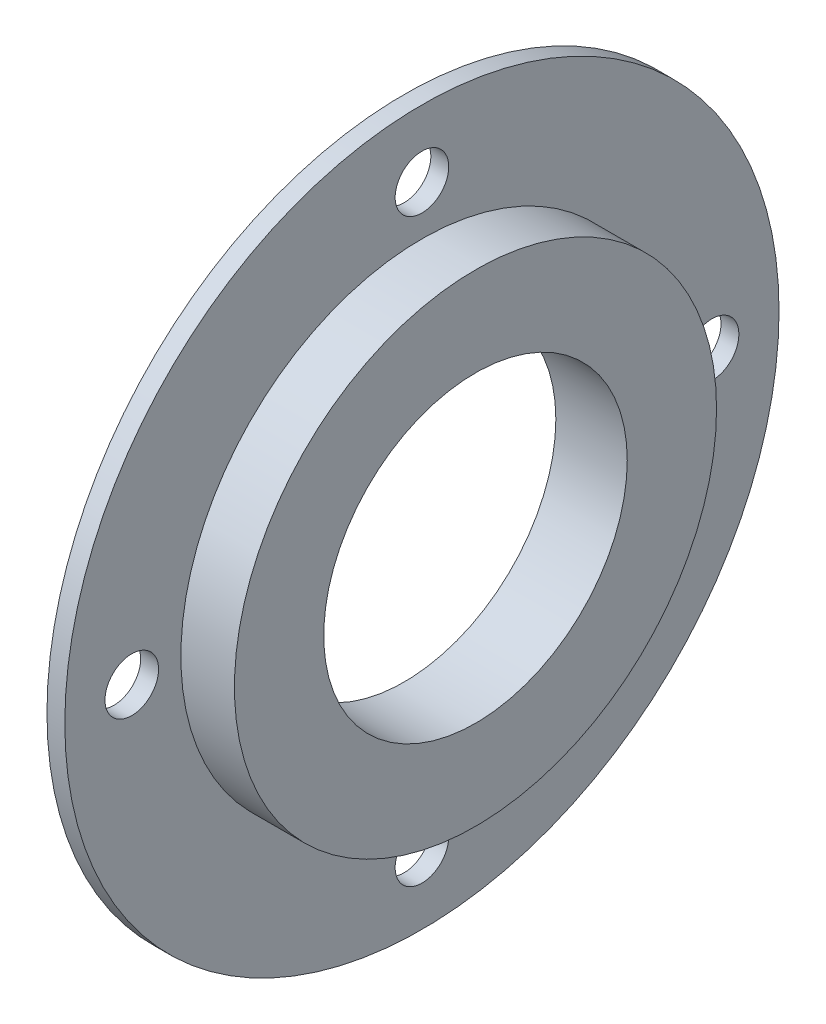
from build123d import *

# Parameters (mm, degrees)
SKETCH3_R          = 17
CUT_EXTRUDE1_DEPTH = 10
SKETCH4_R          = 3
CUT_EXTRUDE2_DEPTH = 28


with BuildPart() as part:
    # Sketch2 → Revolve1 (revolve)
    with BuildSketch(Plane.XY, mode=Mode.PRIVATE) as revolve1_sk:
        Polygon((0, 0), (0, 40), (2, 40), (2, 27), (8, 27), (8, 0), align=None)
    revolve(revolve1_sk.sketch.rotate(Axis((8, 0, 0), (-1, 0, 0)), 90), axis=Axis((8, 0, 0), (-1, 0, 0)))

    # Sketch3 → Cut-Extrude1 (cut)
    with BuildSketch(Plane(origin=(8, 0, 0), x_dir=(0, 0, -1), z_dir=(1, 0, 0))):
        Circle(SKETCH3_R)
    extrude(amount=-CUT_EXTRUDE1_DEPTH, mode=Mode.SUBTRACT)

    # Sketch4 → Cut-Extrude2 (cut)
    with BuildSketch(Plane(origin=(8, 0, 0), x_dir=(0, 0, -1), z_dir=(1, 0, 0))):
        with Locations((0, -32.5)):
            Circle(SKETCH4_R)
        with Locations((32.5, 0)):
            Circle(SKETCH4_R)
        with Locations((0, 32.5)):
            Circle(SKETCH4_R)
        with Locations((-32.5, 0)):
            Circle(SKETCH4_R)
    extrude(amount=-CUT_EXTRUDE2_DEPTH, mode=Mode.SUBTRACT)


solid = part.part
